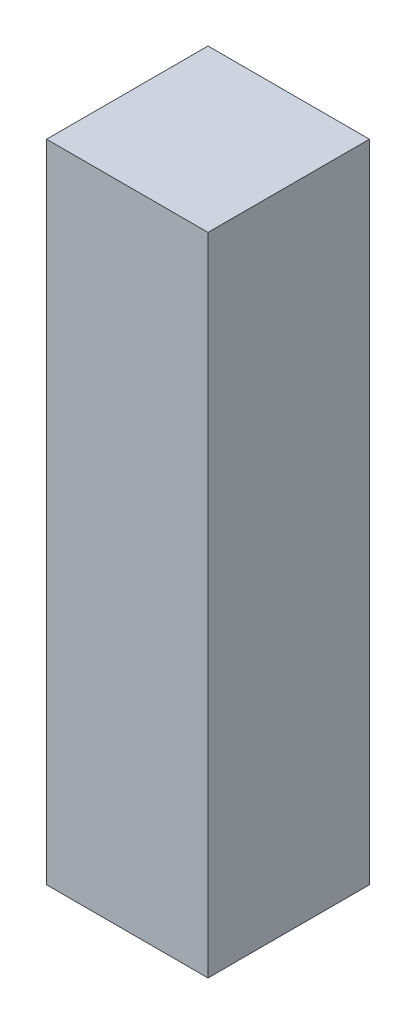
from build123d import *

# Parameters (mm, degrees)
SKETCH1_W           = 5
SKETCH1_H           = 5
BOSS_EXTRUDE1_DEPTH = 20


with BuildPart() as part:
    # Sketch1 → Boss-Extrude1 (new body)
    with BuildSketch(Plane(origin=(0, 0, 0), x_dir=(1, 0, 0), z_dir=(0, 1, 0))):
        Rectangle(SKETCH1_W, SKETCH1_H)
    extrude(amount=BOSS_EXTRUDE1_DEPTH)


solid = part.part
